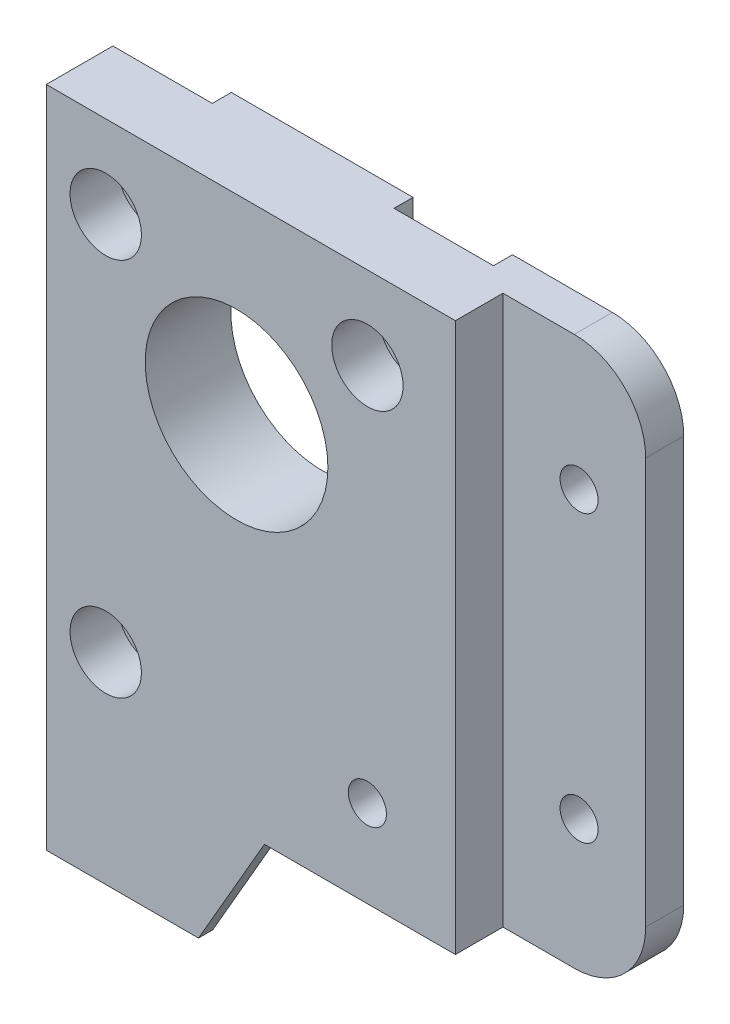
from build123d import *

# Parameters (mm, degrees)
SKETCH1_R           = 9.6
SKETCH1_R_2         = 4.2
BOSS_EXTRUDE1_DEPTH = 2
SKETCH4_W           = 58
SKETCH4_H           = 57.7
SKETCH4_R           = 2
SKETCH4_R_2         = 9.6
BOSS_EXTRUDE3_DEPTH = 2
SKETCH5_R           = 2
CUT_EXTRUDE1_DEPTH  = 4
SKETCH6_W           = 43
SKETCH6_H           = 57.7
SKETCH6_R           = 3.75
SKETCH6_R_2         = 9.6
SKETCH6_R_3         = 2
BOSS_EXTRUDE4_DEPTH = 5
CUT_EXTRUDE2_DEPTH  = 48.972101267
BOSS_EXTRUDE5_DEPTH = 6
BOSS_EXTRUDE6_DEPTH = 1.5


with BuildPart() as part:
    # Sketch1 → Boss-Extrude1 (new body)
    with BuildSketch(Plane.XY):
        with BuildLine():
            Line((38, 28.85), (20, 28.85))
            Line((20, 28.85), (20, 21.79369023))
            Line((20, 21.79369023), (17.201699017, 17.757141063))
            ThreePointArc((17.201699017, 17.757141063), (12.496432266, 16.141438171), (9.55, 20.15))
            Line((9.55, 20.15), (9.55, 28.85))
            Line((9.55, 28.85), (-9.55, 28.85))
            Line((-9.55, 28.85), (-9.55, 20.15))
            ThreePointArc((-9.55, 20.15), (-12.496432266, 16.141438171), (-17.201699017, 17.757141063))
            Line((-17.201699017, 17.757141063), (-20, 21.79369023))
            Line((-20, 21.79369023), (-20, -16.371914064))
            Line((-20, -16.371914064), (-16.312, -16.371914064))
            Line((-16.312, -16.371914064), (-12.349992933, -13.321914064))
            ThreePointArc((-12.349992933, -13.321914064), (-6.459906996, -14.088), (-7.225992933, -19.978085936))
            Line((-7.225992933, -19.978085936), (-11.188, -23.028085936))
            ThreePointArc((-11.188, -23.028085936), (-12.396848296, -23.676050863), (-13.75, -23.9))
            Line((-13.75, -23.9), (-13.75, -28.85))
            Line((-13.75, -28.85), (9.55, -28.85))
            Line((9.55, -28.85), (9.55, -19.7))
            ThreePointArc((9.55, -19.7), (12.496432266, -15.691438171), (17.201699017, -17.307141063))
            Line((17.201699017, -17.307141063), (20, -21.34369023))
            Line((20, -21.34369023), (20, -28.85))
            Line((20, -28.85), (38, -28.85))
            Line((38, -28.85), (38, 28.85))
        make_face()
        with Locations((0, 8.8)):
            Circle(SKETCH1_R, mode=Mode.SUBTRACT)
        with Locations((-5.725, -6.1)):
            Circle(SKETCH1_R_2, mode=Mode.SUBTRACT)
        with Locations((5.725, -6.1)):
            Circle(SKETCH1_R_2, mode=Mode.SUBTRACT)
    extrude(amount=BOSS_EXTRUDE1_DEPTH)

    # Sketch4 → Boss-Extrude3 (add)
    with BuildSketch(Plane.XY.offset(2)):
        with Locations((9, 0)):
            Rectangle(SKETCH4_W, SKETCH4_H)
        with Locations((13.75, -19.7)):
            Circle(SKETCH4_R, mode=Mode.SUBTRACT)
        with Locations((-13.75, 20.15)):
            Circle(SKETCH4_R, mode=Mode.SUBTRACT)
        with Locations((13.75, 20.15)):
            Circle(SKETCH4_R, mode=Mode.SUBTRACT)
        with Locations((-13.75, -19.7)):
            Circle(SKETCH4_R, mode=Mode.SUBTRACT)
        with Locations((0, 8.8)):
            Circle(SKETCH4_R_2, mode=Mode.SUBTRACT)
    extrude(amount=BOSS_EXTRUDE3_DEPTH)

    # Sketch5 → Cut-Extrude1 (cut)
    with BuildSketch(Plane.XY.offset(4)):
        with Locations((31, 15)):
            Circle(SKETCH5_R)
        with Locations((31, -15)):
            Circle(SKETCH5_R)
    extrude(amount=-CUT_EXTRUDE1_DEPTH, mode=Mode.SUBTRACT)

    # Sketch6 → Boss-Extrude4 (add)
    with BuildSketch(Plane.XY.offset(4)):
        with Locations((1.5, 0)):
            Rectangle(SKETCH6_W, SKETCH6_H)
        with Locations((-13.75, -19.7)):
            Circle(SKETCH6_R, mode=Mode.SUBTRACT)
        with Locations((0, 8.8)):
            Circle(SKETCH6_R_2, mode=Mode.SUBTRACT)
        with Locations((-13.75, 20.15)):
            Circle(SKETCH6_R, mode=Mode.SUBTRACT)
        with Locations((13.75, 20.15)):
            Circle(SKETCH6_R, mode=Mode.SUBTRACT)
        with Locations((13.75, -19.7)):
            Circle(SKETCH6_R_3, mode=Mode.SUBTRACT)
    extrude(amount=BOSS_EXTRUDE4_DEPTH)

    # Sketch7 → Cut-Extrude2 (cut, through all)
    with BuildSketch(Plane.XY.offset(4)):
        with BuildLine():
            Line((30.5, 28.85), (38, 28.85))
            Line((38, 28.85), (38, 21.35))
            ThreePointArc((38, 21.35), (35.803300859, 26.653300859), (30.5, 28.85))
        make_face()
        with BuildLine():
            Line((38, -28.85), (38, -21.35))
            ThreePointArc((38, -21.35), (35.803300859, -26.653300859), (30.5, -28.85))
            Line((30.5, -28.85), (38, -28.85))
        make_face()
    extrude(amount=-CUT_EXTRUDE2_DEPTH, mode=Mode.SUBTRACT)

    # Sketch9 → Boss-Extrude5 (add)
    with BuildSketch(Plane.ZY.offset(20)):
        Polygon((9, -28.85), (9, -40.85), (0, -40.85), (0, -35.15), (3, -35.15), (3, -28.85), align=None)
    extrude(amount=-BOSS_EXTRUDE5_DEPTH)

    # Sketch10 → Boss-Extrude6 (add)
    with BuildSketch(Plane.XY.offset(9)):
        Polygon((-14, -40.85), (-4, -40.85), (2.92820323, -28.85), (-14, -28.85), align=None)
    extrude(amount=-BOSS_EXTRUDE6_DEPTH)


solid = part.part
